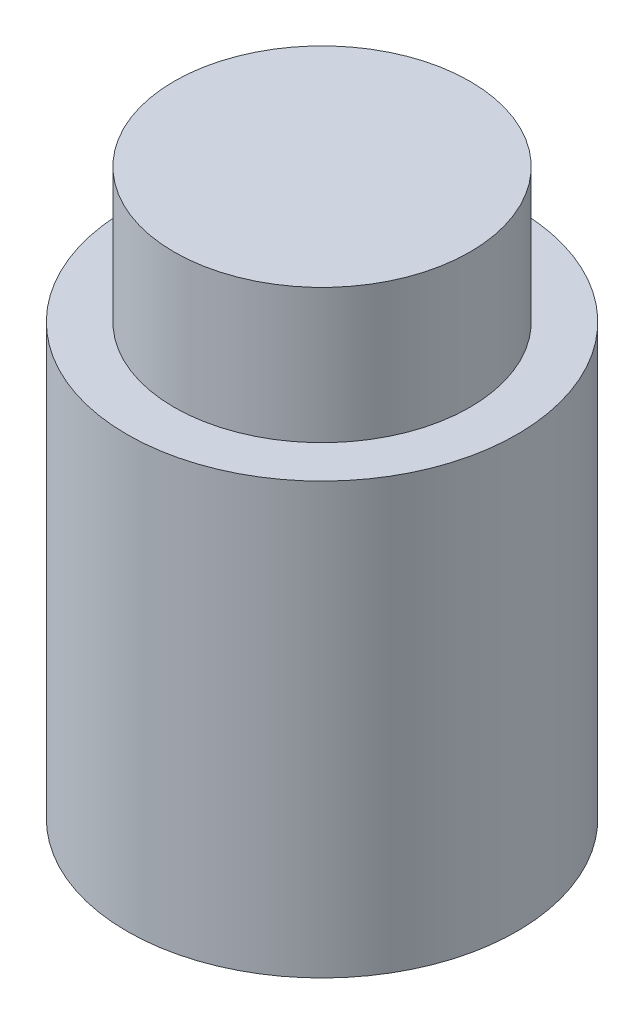
from build123d import *

# Parameters (mm, degrees)
SKETCH_1_R          = 5.5
EXTRUDE_1_DEPTH     = 5
SKETCH_2_R          = 7.25
EXTRUDE_2_DEPTH     = 16
CUT_EXTRUDE_1_DEPTH = 13.5
SKETCH_4_R          = 3.025
CUT_EXTRUDE_2_DEPTH = 6.5
SKETCH_5_R          = 3.525
CUT_EXTRUDE_3_DEPTH = 4.5


with BuildPart() as part:
    # Эскиз1 → Бобышка-Вытянуть1 (new body)
    with BuildSketch(Plane(origin=(0, 0, 0), x_dir=(1, 0, 0), z_dir=(0, 1, 0))):
        Circle(SKETCH_1_R)
    extrude(amount=EXTRUDE_1_DEPTH)

    # Эскиз2 → Бобышка-Вытянуть2 (add)
    with BuildSketch(Plane(origin=(0, 0, 0), x_dir=(1, 0, 0), z_dir=(0, 1, 0))):
        Circle(SKETCH_2_R)
    extrude(amount=-EXTRUDE_2_DEPTH)

    # Эскиз3 → Вырез-Вытянуть1 (cut)
    with BuildSketch(Plane.XZ.offset(16)):
        with BuildLine():
            Line((2.626904071, 1.5), (-2.626904071, 1.5))
            ThreePointArc((-2.626904071, 1.5), (-0.775963976, -2.923782637), (3.025, 0))
            ThreePointArc((3.025, 0), (2.923782637, 0.775963976), (2.626904071, 1.5))
        make_face()
    extrude(amount=-CUT_EXTRUDE_1_DEPTH, mode=Mode.SUBTRACT)

    # Эскиз4 → Вырез-Вытянуть2 (cut)
    with BuildSketch(Plane.XZ.offset(16)):
        Circle(SKETCH_4_R)
    extrude(amount=-CUT_EXTRUDE_2_DEPTH, mode=Mode.SUBTRACT)

    # Эскиз5 → Вырез-Вытянуть3 (cut)
    with BuildSketch(Plane.XZ.offset(16)):
        Circle(SKETCH_5_R)
    extrude(amount=-CUT_EXTRUDE_3_DEPTH, mode=Mode.SUBTRACT)


solid = part.part
